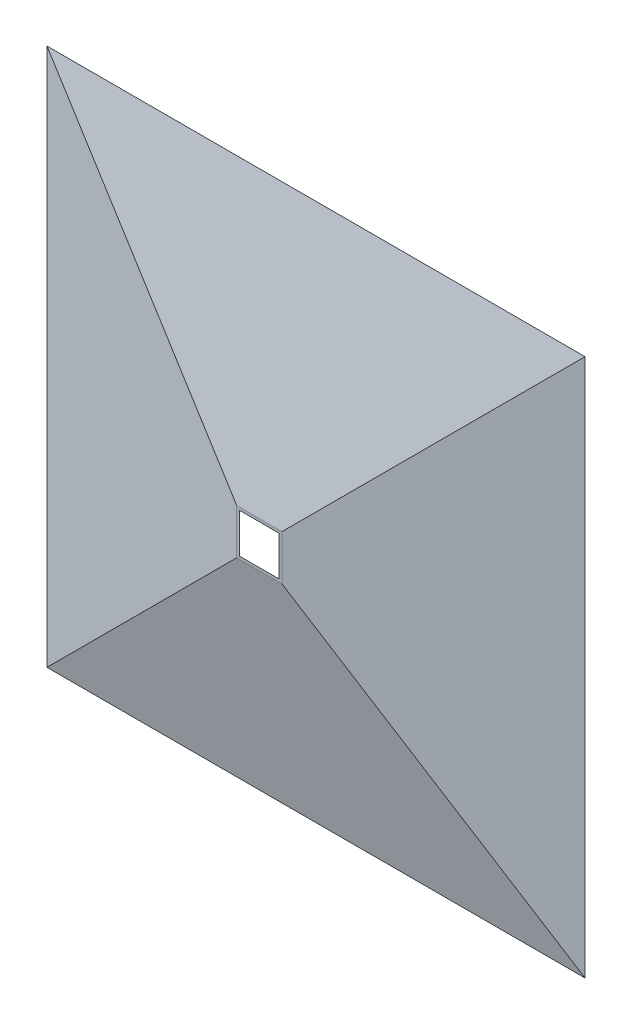
from build123d import *


with BuildPart() as part:
    # 草图1 → Loft 1 section 0
    with BuildSketch(Plane.XY):
        with BuildLine():
            Line((-475, 475), (475, 475))
            Line((475, 475), (475, -475))
            Line((475, -475), (-475, -475))
            Line((-475, -475), (-475, 475))
        make_face()
    # 草图2 → Loft 1 section 1
    with BuildSketch(Plane.XY.offset(100)):
        with BuildLine():
            Line((-40, 40), (40, 40))
            Line((40, 40), (40, -40))
            Line((40, -40), (-40, -40))
            Line((-40, -40), (-40, 40))
        make_face()
    loft()

    # 草图3 → Loft 1 2 section 0
    with BuildSketch(Plane(origin=(0, 0, 0), x_dir=(-1, 0, 0), z_dir=(0, 0, -1))):
        with BuildLine():
            Line((470, -470), (-470, -470))
            Line((-470, -470), (-470, 470))
            Line((-470, 470), (470, 470))
            Line((470, 470), (470, -470))
        make_face()
    # 草图4 → Loft 1 2 section 1
    with BuildSketch(Plane.XY.offset(100)):
        with BuildLine():
            Line((-35, 35), (35, 35))
            Line((35, 35), (35, -35))
            Line((35, -35), (-35, -35))
            Line((-35, -35), (-35, 35))
        make_face()
    loft(mode=Mode.SUBTRACT)


solid = part.part
